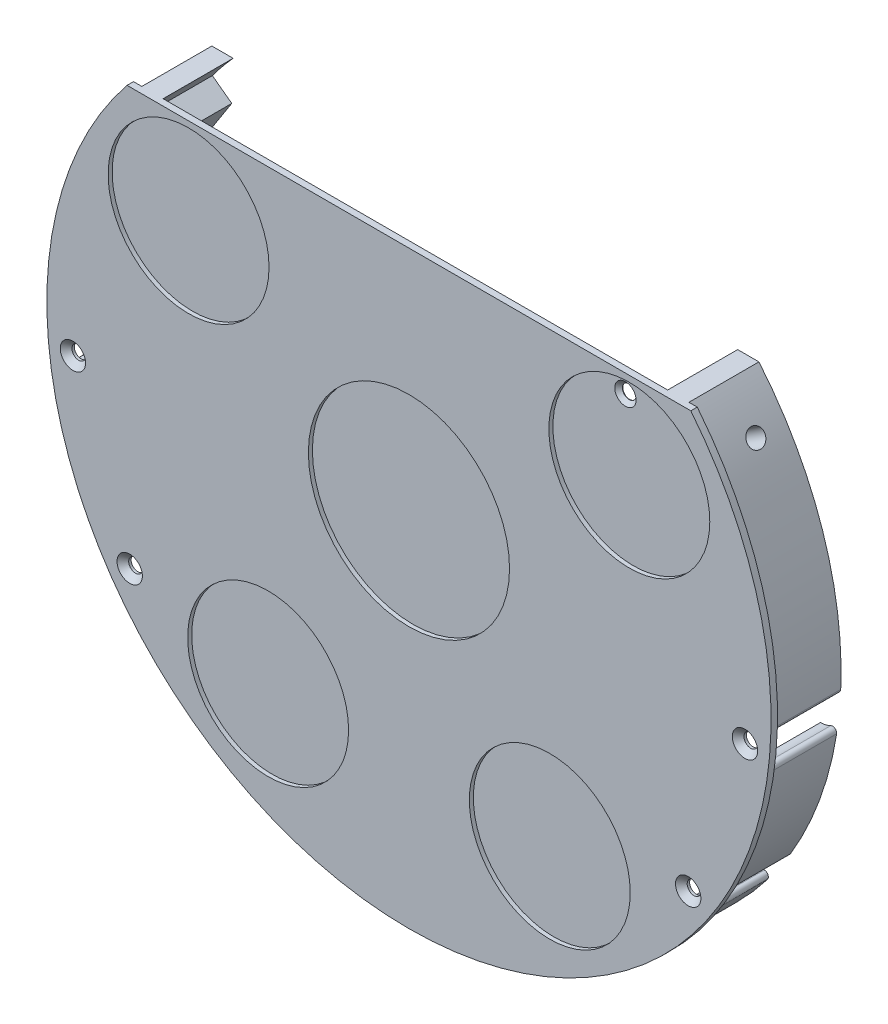
from build123d import *
from build123d.topology import SkipClean

# Parameters (mm, degrees)
SKETCH1_R                                            = 1.7
BOSS_EXTRUDE1_DEPTH                                  = 2
CUT_EXTRUDE1_START                                   = -0.5
SKETCH3_R                                            = 20
SKETCH3_R_2                                          = 25
SKETCH3_R_3                                          = 1.7
CUT_EXTRUDE1_DEPTH                                   = 0.5
BOSS_EXTRUDE2_START                                  = 2
SKETCH4_R                                            = 3
BOSS_EXTRUDE2_DEPTH                                  = 2
BOSS_EXTRUDE3_DEPTH                                  = 15
FILLET1_R                                            = 1
BOSS_EXTRUDE4_START                                  = -15
BOSS_EXTRUDE4_DEPTH                                  = 15
SKETCH7_R                                            = 2.2
CUT_EXTRUDE2_DEPTH                                   = 206.105838741
CSK_FOR_M3_FLAT_HEAD_MACHINE_SCREW1_D                = 3.4
CSK_FOR_M3_FLAT_HEAD_MACHINE_SCREW1_CSINK_D          = 6.3
CSK_FOR_M3_FLAT_HEAD_MACHINE_SCREW1_CSINK_ANGLE      = 90
CSK_FOR_M3_FLAT_HEAD_MACHINE_SCREW1_ON_F_D           = 3.4
CSK_FOR_M3_FLAT_HEAD_MACHINE_SCREW1_ON_F_CSINK_D     = 6.3
CSK_FOR_M3_FLAT_HEAD_MACHINE_SCREW1_ON_F_CSINK_ANGLE = 90
BOSS_EXTRUDE5_START                                  = 0.3
SKETCH10_R                                           = 3
SKETCH10_R_2                                         = 1.7
BOSS_EXTRUDE5_DEPTH                                  = 0.3
SKETCH11_R                                           = 2.5
BOSS_EXTRUDE6_DEPTH                                  = 5
CUT_EXTRUDE3_DEPTH                                   = 131.570134491
CUT_EXTRUDE8_START                                   = -0.5
SKETCH14_R                                           = 20
SKETCH14_R_2                                         = 25
CUT_EXTRUDE8_DEPTH                                   = 0.5
CUT_EXTRUDE9_START                                   = -2.4
SKETCH17_R                                           = 3
CUT_EXTRUDE9_DEPTH                                   = 2.4
SKETCH18_R                                           = 3
SKETCH18_R_2                                         = 1.7
CUT_EXTRUDE10_DEPTH                                  = 0.25


with BuildPart() as part:
    # Sketch1 → Boss-Extrude1 (new body)
    with BuildSketch(Plane.XY):
        with BuildLine():
            ThreePointArc((70.055335271, 56.5), (0, -90), (-70.055335271, 56.5))
            Line((-70.055335271, 56.5), (70.055335271, 56.5))
        make_face()
        with Locations((69.405322414, -47.216282822)):
            Circle(SKETCH1_R, mode=Mode.SUBTRACT)
        with Locations((83.517603132, -8.443110213)):
            Circle(SKETCH1_R, mode=Mode.SUBTRACT)
        with Locations((52.8, 51)):
            Circle(SKETCH1_R, mode=Mode.SUBTRACT)
        with Locations((-69.405322414, -47.216282822)):
            Circle(SKETCH1_R, mode=Mode.SUBTRACT)
        with Locations((-83.517603132, -8.443110213)):
            Circle(SKETCH1_R, mode=Mode.SUBTRACT)
    extrude(amount=BOSS_EXTRUDE1_DEPTH)

    # Sketch3 → Cut-Extrude1 (cut)
    # profile 1 of 5: a face of its own
    with BuildSketch(Plane.XY.offset(2).offset(CUT_EXTRUDE1_START)):
        with Locations((-54.772, 35)):
            Circle(SKETCH3_R)
    # profile 2 of 5: a face of its own
    with BuildSketch(Plane.XY.offset(2).offset(CUT_EXTRUDE1_START)):
        with Locations((-35, -54.772255751)):
            Circle(SKETCH3_R)
    # profile 3 of 5: a face of its own
    with BuildSketch(Plane.XY.offset(2).offset(CUT_EXTRUDE1_START)):
        Circle(SKETCH3_R_2)
    # profile 4 of 5: a face of its own
    with BuildSketch(Plane.XY.offset(2).offset(CUT_EXTRUDE1_START)):
        with Locations((35.000400226, -54.772)):
            Circle(SKETCH3_R)
    # profile 5 of 5: a face of its own
    with BuildSketch(Plane.XY.offset(2).offset(CUT_EXTRUDE1_START)):
        with Locations((54.772255751, 35)):
            Circle(SKETCH3_R)
        with Locations((52.8, 51)):
            Circle(SKETCH3_R_3, mode=Mode.SUBTRACT)
    extrude(amount=CUT_EXTRUDE1_DEPTH, mode=Mode.SUBTRACT)

    # Sketch4 → Boss-Extrude2 (add)
    with BuildSketch(Plane(origin=(0, 0, 0), x_dir=(-1, 0, 0), z_dir=(0, 0, -1)).offset(BOSS_EXTRUDE2_START)):
        with BuildLine():
            Line((70.055335271, 56.5), (-70.055335271, 56.5))
            ThreePointArc((-70.055335271, 56.5), (0, -90), (70.055335271, 56.5))
        make_face()
        with Locations((83.517603132, -8.443110213)):
            Circle(SKETCH4_R, mode=Mode.SUBTRACT)
        with Locations((69.405322414, -47.216282822)):
            Circle(SKETCH4_R, mode=Mode.SUBTRACT)
        with Locations((-69.405322414, -47.216282822)):
            Circle(SKETCH4_R, mode=Mode.SUBTRACT)
        with Locations((-83.517603132, -8.443110213)):
            Circle(SKETCH4_R, mode=Mode.SUBTRACT)
        with Locations((-52.8, 51)):
            Circle(SKETCH4_R, mode=Mode.SUBTRACT)
    extrude(amount=-BOSS_EXTRUDE2_DEPTH)

    # Sketch5 → Boss-Extrude3 (add)
    with BuildSketch(Plane(origin=(0, 0, -2), x_dir=(-1, 0, 0), z_dir=(0, 0, -1))):
        with BuildLine():
            Line((-62.698564577, 56.5), (-67.987572394, 56.5))
            ThreePointArc((-67.987572394, 56.5), (-84.200541737, 26.922644209), (-88.155200716, -6.574236584))
            ThreePointArc((-88.155200716, -6.574236584), (-86.642714353, -4.540075515), (-84.327021123, -3.509060911))
            ThreePointArc((-84.327021123, -3.509060911), (-79.400268013, 28.617432441), (-62.698564577, 56.5))
        make_face()
        with BuildLine():
            ThreePointArc((-83.323132994, -13.439326918), (-85.798321964, -12.892640706), (-87.687327308, -11.202349292))
            ThreePointArc((-87.687327308, -11.202349292), (-83.068827677, -30.23458067), (-74.37312114, -47.782830095))
            ThreePointArc((-74.37312114, -47.782830095), (-74.012557471, -45.273762521), (-72.467855839, -43.263955784))
            ThreePointArc((-72.467855839, -43.263955784), (-79.310057194, -28.866500097), (-83.323132994, -13.439326918))
        make_face()
        with BuildLine():
            ThreePointArc((87.687327308, -11.202349292), (85.798321964, -12.892640706), (83.323132994, -13.439326918))
            ThreePointArc((83.323132994, -13.439326918), (79.310057194, -28.866500097), (72.467855839, -43.263955784))
            ThreePointArc((72.467855839, -43.263955784), (74.012557471, -45.273762521), (74.37312114, -47.782830095))
            ThreePointArc((74.37312114, -47.782830095), (83.068827677, -30.23458067), (87.687327308, -11.202349292))
        make_face()
        with BuildLine():
            Line((67.987572394, 56.5), (62.698564577, 56.5))
            ThreePointArc((62.698564577, 56.5), (79.400268013, 28.617432441), (84.327021123, -3.509060911))
            ThreePointArc((84.327021123, -3.509060911), (86.642714353, -4.540075515), (88.155200716, -6.574236584))
            ThreePointArc((88.155200716, -6.574236584), (84.200541737, 26.922644209), (67.987572394, 56.5))
        make_face()
        with BuildLine():
            ThreePointArc((-66.853826811, -51.516267729), (-69.290474155, -52.214963636), (-71.75663946, -51.628913347))
            ThreePointArc((-71.75663946, -51.628913347), (0, -88.4), (71.75663946, -51.628913347))
            ThreePointArc((71.75663946, -51.628913347), (69.290474155, -52.214963636), (66.853826811, -51.516267729))
            ThreePointArc((66.853826811, -51.516267729), (0, -84.4), (-66.853826811, -51.516267729))
        make_face()
    extrude(amount=BOSS_EXTRUDE3_DEPTH)

    # Fillet1
    fillet1_edges = [part.edges().sort_by_distance(p)[0] for p in [
        (88.155200716, -6.574236584, -9.5),
        (87.687327308, -11.202349292, -9.5),
        (74.37312114, -47.782830095, -9.5),
        (71.75663946, -51.628913347, -9.5),
        (-71.75663946, -51.628913347, -9.5),
        (-74.37312114, -47.782830095, -9.5),
        (-87.687327308, -11.202349292, -9.5),
        (-88.155200716, -6.574236584, -9.5),
    ]]
    fillet(fillet1_edges, radius=FILLET1_R)

    # Sketch6 → Boss-Extrude4 (add)
    with SkipClean():  # the faces are left unmerged after this step: merging them gives an invalid solid
        with BuildSketch(Plane(origin=(0, 0, -17), x_dir=(-1, 0, 0), z_dir=(0, 0, -1)).offset(BOSS_EXTRUDE4_START)):
            with BuildLine():
                Line((-63.033284371, 46.619363589), (-67.857260215, 50.187172027))
                ThreePointArc((-67.857260215, 50.187172027), (-71.144699305, 45.406957185), (-74.095981351, 40.412195531))
                Line((-74.095981351, 40.412195531), (-69.301244454, 36.866012194))
                Line((-69.301244454, 36.866012194), (-63.033284371, 46.619363589))
            make_face()
            with BuildLine():
                ThreePointArc((71.073244112, 52.565710986), (74.367291751, 47.791902218), (77.341204195, 42.812359591))
                Line((77.341204195, 42.812359591), (69.301244454, 36.866012194))
                Line((69.301244454, 36.866012194), (63.033284371, 46.619363589))
                Line((63.033284371, 46.619363589), (71.073244112, 52.565710986))
            make_face()
        extrude(amount=BOSS_EXTRUDE4_DEPTH)

    # Sketch7 → Cut-Extrude2 (cut, through all)
    with SkipClean():  # the faces are left unmerged after this step: merging them gives an invalid solid
        with BuildSketch(Plane(origin=(-65.812741783, 42.294348038, 0), x_dir=(0, 0, -1), z_dir=(0.8412589564600713, -0.5406323780312386, 0))):
            with Locations(Location((9.5, -0.655755451, 0), (0, 0, 90))):
                Circle(SKETCH7_R)
        cut_extrude2 = extrude(amount=-CUT_EXTRUDE2_DEPTH, mode=Mode.SUBTRACT)

    # Mirror1: Cut-Extrude2 across plane
    with SkipClean():  # the faces are left unmerged after this step: merging them gives an invalid solid
        add(cut_extrude2.mirror(Plane(origin=(0, 0, 0), x_dir=(0, 0, 1), z_dir=(1, 0, 0))), mode=Mode.SUBTRACT)

    # CSK for M3 Flat Head Machine Screw1 (through all)
    with Locations(Plane(origin=(83.517603132, -8.443110213, 2), x_dir=(1, 0, 0), z_dir=(0, 0, 1))):
        with Locations((0, 0), (-14.112280718, -38.773172609), (-152.922925546, -38.773172609), (-167.035206264, 0)):
            CounterSinkHole(CSK_FOR_M3_FLAT_HEAD_MACHINE_SCREW1_D / 2, CSK_FOR_M3_FLAT_HEAD_MACHINE_SCREW1_CSINK_D / 2, counter_sink_angle=CSK_FOR_M3_FLAT_HEAD_MACHINE_SCREW1_CSINK_ANGLE)

    # CSK for M3 Flat Head Machine Screw1 on f (through all)
    with Locations(Plane(origin=(52.8, 51, 1.5), x_dir=(1, 0, 0), z_dir=(0, 0, 1))):
        with Locations((0, 0)):
            CounterSinkHole(CSK_FOR_M3_FLAT_HEAD_MACHINE_SCREW1_ON_F_D / 2, CSK_FOR_M3_FLAT_HEAD_MACHINE_SCREW1_ON_F_CSINK_D / 2, counter_sink_angle=CSK_FOR_M3_FLAT_HEAD_MACHINE_SCREW1_ON_F_CSINK_ANGLE)

    # Sketch10 → Boss-Extrude5 (add)
    # profile 1 of 5: a face of its own
    with SkipClean():  # the faces are left unmerged after this step: merging them gives an invalid solid
        with BuildSketch(Plane(origin=(0, 0, 0), x_dir=(-1, 0, 0), z_dir=(0, 0, -1)).offset(BOSS_EXTRUDE5_START)):
            with Locations((-83.517603132, -8.443110213)):
                Circle(SKETCH10_R)
            with Locations((-83.517603132, -8.443110213)):
                Circle(SKETCH10_R_2, mode=Mode.SUBTRACT)
        # profile 2 of 5: a face of its own
        with BuildSketch(Plane(origin=(0, 0, 0), x_dir=(-1, 0, 0), z_dir=(0, 0, -1)).offset(BOSS_EXTRUDE5_START)):
            with Locations((-69.405322414, -47.216282822)):
                Circle(SKETCH10_R)
            with Locations((-69.405322414, -47.216282822)):
                Circle(SKETCH10_R_2, mode=Mode.SUBTRACT)
        # profile 3 of 5: a face of its own
        with BuildSketch(Plane(origin=(0, 0, 0), x_dir=(-1, 0, 0), z_dir=(0, 0, -1)).offset(BOSS_EXTRUDE5_START)):
            with Locations((69.405322414, -47.216282822)):
                Circle(SKETCH10_R)
            with Locations((69.405322414, -47.216282822)):
                Circle(SKETCH10_R_2, mode=Mode.SUBTRACT)
        # profile 4 of 5: a face of its own
        with BuildSketch(Plane(origin=(0, 0, 0), x_dir=(-1, 0, 0), z_dir=(0, 0, -1)).offset(BOSS_EXTRUDE5_START)):
            with Locations((83.517603132, -8.443110213)):
                Circle(SKETCH10_R)
            with Locations((83.517603132, -8.443110213)):
                Circle(SKETCH10_R_2, mode=Mode.SUBTRACT)
        # profile 5 of 5: a face of its own
        with BuildSketch(Plane(origin=(0, 0, 0), x_dir=(-1, 0, 0), z_dir=(0, 0, -1)).offset(BOSS_EXTRUDE5_START)):
            with Locations((-52.8, 51)):
                Circle(SKETCH10_R)
            with Locations((-52.8, 51)):
                Circle(SKETCH10_R_2, mode=Mode.SUBTRACT)
        extrude(amount=-BOSS_EXTRUDE5_DEPTH)

    # Sketch14 → Cut-Extrude8 (cut)
    with SkipClean():  # the faces are left unmerged after this step: merging them gives an invalid solid
        with BuildSketch(Plane.XY.offset(1.5).offset(CUT_EXTRUDE8_START)):
            with Locations((-54.772, 35)):
                Circle(SKETCH14_R)
            with Locations((54.772255751, 35)):
                Circle(SKETCH14_R)
            with Locations((35.000400226, -54.772)):
                Circle(SKETCH14_R)
            with Locations((-35, -54.772255751)):
                Circle(SKETCH14_R)
            Circle(SKETCH14_R_2)
        extrude(amount=CUT_EXTRUDE8_DEPTH, mode=Mode.SUBTRACT)

    # Sketch17 → Cut-Extrude9 (cut)
    with SkipClean():  # the faces are left unmerged after this step: merging them gives an invalid solid
        with BuildSketch(Plane(origin=(0, 0, -2), x_dir=(-1, 0, 0), z_dir=(0, 0, -1)).offset(CUT_EXTRUDE9_START)):
            with BuildLine():
                Line((-85.575565432, -3.886270171), (-86.684073662, -4.573554116))
                ThreePointArc((-86.684073662, -4.573554116), (-87.725815738, -4.712424501), (-88.316422319, -3.843117072))
                ThreePointArc((-88.316422319, -3.843117072), (-83.773848158, 28.222373478), (-67.987572394, 56.5))
                Line((-67.987572394, 56.5), (-70.055335271, 56.5))
                ThreePointArc((-70.055335271, 56.5), (0, -90), (70.055335271, 56.5))
                Line((70.055335271, 56.5), (67.987572394, 56.5))
                ThreePointArc((67.987572394, 56.5), (69.558229774, 54.554675975), (71.073244112, 52.565710986))
                ThreePointArc((71.073244112, 52.565710986), (74.367291751, 47.791902218), (77.341204195, 42.812359591))
                ThreePointArc((77.341204195, 42.812359591), (86.051122486, 20.242636163), (88.316422319, -3.843117072))
                ThreePointArc((88.316422319, -3.843117072), (87.725815738, -4.712424501), (86.684073662, -4.573554116))
                Line((86.684073662, -4.573554116), (85.575565432, -3.886270171))
                Line((85.575565432, -3.886270171), (84.327021123, -3.509060911))
                ThreePointArc((84.327021123, -3.509060911), (82.199337711, 19.147555455), (74.095981351, 40.412195531))
                Line((74.095981351, 40.412195531), (69.301244454, 36.866012194))
                Line((69.301244454, 36.866012194), (63.033284371, 46.619363589))
                Line((63.033284371, 46.619363589), (67.857260215, 50.187172027))
                ThreePointArc((67.857260215, 50.187172027), (65.354179637, 53.405909822), (62.698564577, 56.5))
                Line((62.698564577, 56.5), (-62.698564577, 56.5))
                ThreePointArc((-62.698564577, 56.5), (-65.354179637, 53.405909822), (-67.857260215, 50.187172027))
                Line((-67.857260215, 50.187172027), (-63.033284371, 46.619363589))
                Line((-63.033284371, 46.619363589), (-69.301244454, 36.866012194))
                Line((-69.301244454, 36.866012194), (-74.095981351, 40.412195531))
                ThreePointArc((-74.095981351, 40.412195531), (-82.199337711, 19.147555455), (-84.327021123, -3.509060911))
                Line((-84.327021123, -3.509060911), (-85.575565432, -3.886270171))
            make_face()
            with Locations((-69.405322414, -47.216282822)):
                Circle(SKETCH17_R, mode=Mode.SUBTRACT)
            with BuildLine():
                ThreePointArc((-87.298674851, -13.910476959), (-86.894002312, -12.940554204), (-85.845544922, -12.868117221))
                Line((-85.845544922, -12.868117221), (-84.621910812, -13.319636081))
                Line((-84.621910812, -13.319636081), (-83.323132994, -13.439326918))
                ThreePointArc((-83.323132994, -13.439326918), (-79.310057194, -28.866500097), (-72.467855839, -43.263955784))
                Line((-72.467855839, -43.263955784), (-73.385841582, -44.190482574))
                Line((-73.385841582, -44.190482574), (-74.032968964, -45.322902933))
                ThreePointArc((-74.032968964, -45.322902933), (-74.882695412, -45.941349779), (-75.816146995, -45.458462961))
                ThreePointArc((-75.816146995, -45.458462961), (-83.068827677, -30.23458067), (-87.298674851, -13.910476959))
            make_face(mode=Mode.SUBTRACT)
            with BuildLine():
                ThreePointArc((-70.12461259, -53.824703521), (-70.230961745, -52.779140804), (-69.343676854, -52.215902791))
                Line((-69.343676854, -52.215902791), (-68.05273268, -52.029857483))
                Line((-68.05273268, -52.029857483), (-66.853826811, -51.516267729))
                ThreePointArc((-66.853826811, -51.516267729), (0, -84.4), (66.853826811, -51.516267729))
                Line((66.853826811, -51.516267729), (68.05273268, -52.029857483))
                Line((68.05273268, -52.029857483), (69.343676854, -52.215902791))
                ThreePointArc((69.343676854, -52.215902791), (70.230961745, -52.779140804), (70.12461259, -53.824703521))
                ThreePointArc((70.12461259, -53.824703521), (0, -88.4), (-70.12461259, -53.824703521))
            make_face(mode=Mode.SUBTRACT)
            with Locations((69.405322414, -47.216282822)):
                Circle(SKETCH17_R, mode=Mode.SUBTRACT)
            with BuildLine():
                Line((74.032968964, -45.322902933), (73.385841582, -44.190482574))
                Line((73.385841582, -44.190482574), (72.467855839, -43.263955784))
                ThreePointArc((72.467855839, -43.263955784), (79.310057194, -28.866500097), (83.323132994, -13.439326918))
                Line((83.323132994, -13.439326918), (84.621910812, -13.319636081))
                Line((84.621910812, -13.319636081), (85.845544922, -12.868117221))
                ThreePointArc((85.845544922, -12.868117221), (86.894002312, -12.940554204), (87.298674851, -13.910476959))
                ThreePointArc((87.298674851, -13.910476959), (83.068827677, -30.23458067), (75.816146995, -45.458462961))
                ThreePointArc((75.816146995, -45.458462961), (74.882695412, -45.941349779), (74.032968964, -45.322902933))
            make_face(mode=Mode.SUBTRACT)
            with Locations((-83.517603132, -8.443110213)):
                Circle(SKETCH17_R, mode=Mode.SUBTRACT)
            with Locations((-52.8, 51)):
                Circle(SKETCH17_R, mode=Mode.SUBTRACT)
            with Locations((83.517603132, -8.443110213)):
                Circle(SKETCH17_R, mode=Mode.SUBTRACT)
        extrude(amount=CUT_EXTRUDE9_DEPTH, mode=Mode.SUBTRACT)

    # Sketch18 → Cut-Extrude10 (cut)
    # profile 1 of 5: a face of its own
    with SkipClean():  # the faces are left unmerged after this step: merging them gives an invalid solid
        with BuildSketch(Plane(origin=(0, 0, -0.3), x_dir=(-1, 0, 0), z_dir=(0, 0, -1))):
            with Locations((-83.517603132, -8.443110213)):
                Circle(SKETCH18_R)
            with Locations((-83.517603132, -8.443110213)):
                Circle(SKETCH18_R_2, mode=Mode.SUBTRACT)
        # profile 2 of 5: a face of its own
        with BuildSketch(Plane(origin=(0, 0, -0.3), x_dir=(-1, 0, 0), z_dir=(0, 0, -1))):
            with Locations((-52.8, 51)):
                Circle(SKETCH18_R)
            with Locations((-52.8, 51)):
                Circle(SKETCH18_R_2, mode=Mode.SUBTRACT)
        # profile 3 of 5: a face of its own
        with BuildSketch(Plane(origin=(0, 0, -0.3), x_dir=(-1, 0, 0), z_dir=(0, 0, -1))):
            with Locations((83.517603132, -8.443110213)):
                Circle(SKETCH18_R)
            with Locations((83.517603132, -8.443110213)):
                Circle(SKETCH18_R_2, mode=Mode.SUBTRACT)
        # profile 4 of 5: a face of its own
        with BuildSketch(Plane(origin=(0, 0, -0.3), x_dir=(-1, 0, 0), z_dir=(0, 0, -1))):
            with Locations((69.405322414, -47.216282822)):
                Circle(SKETCH18_R)
            with Locations((69.405322414, -47.216282822)):
                Circle(SKETCH18_R_2, mode=Mode.SUBTRACT)
        # profile 5 of 5: a face of its own
        with BuildSketch(Plane(origin=(0, 0, -0.3), x_dir=(-1, 0, 0), z_dir=(0, 0, -1))):
            with Locations((-69.405322414, -47.216282822)):
                Circle(SKETCH18_R)
            with Locations((-69.405322414, -47.216282822)):
                Circle(SKETCH18_R_2, mode=Mode.SUBTRACT)
        extrude(amount=-CUT_EXTRUDE10_DEPTH, mode=Mode.SUBTRACT)


with BuildPart() as body_2:
    # Sketch11 → Boss-Extrude6 (new body)
    with BuildSketch(Plane(origin=(0, -88.4, 0), x_dir=(-1, 0, 0), z_dir=(0, -1, 0))):
        with Locations(Location((0, 9.5, 0), (0, 0, 90))):
            Circle(SKETCH11_R)
    extrude(amount=BOSS_EXTRUDE6_DEPTH)

    # Sketch12 → Cut-Extrude3 (cut, through all)
    with BuildSketch(Plane(origin=(0, 0, -2), x_dir=(-1, 0, 0), z_dir=(0, 0, -1))):
        with BuildLine():
            Line((-2.5, -89.965271077), (-4.540917511, -95.202364875))
            Line((-4.540917511, -95.202364875), (4.007824165, -95.202364875))
            Line((4.007824165, -95.202364875), (2.5, -89.965271077))
            ThreePointArc((2.5, -89.965271077), (0, -90), (-2.5, -89.965271077))
        make_face()
    extrude(amount=CUT_EXTRUDE3_DEPTH, mode=Mode.SUBTRACT)


solid = Compound([part.part, body_2.part])
